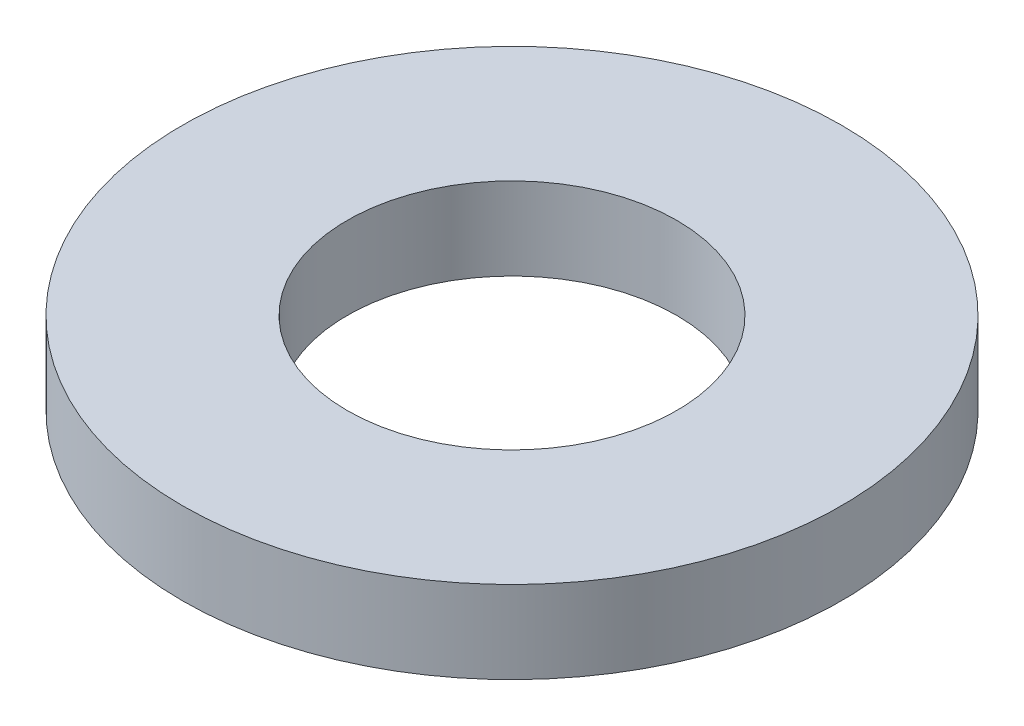
from build123d import *

# Parameters (mm, degrees)
SKETCH1_R           = 6.35
BOSS_EXTRUDE1_DEPTH = 1.5875
SKETCH2_R           = 3.175
CUT_EXTRUDE1_DEPTH  = 17.4625


with BuildPart() as part:
    # Sketch1 → Boss-Extrude1 (new body)
    with BuildSketch(Plane(origin=(0, 0, 0), x_dir=(1, 0, 0), z_dir=(0, 1, 0))):
        with Locations(Location((0, 0, 0), (0, 0, 270))):
            Circle(SKETCH1_R)
    extrude(amount=BOSS_EXTRUDE1_DEPTH)

    # Sketch2 → Cut-Extrude1 (cut)
    with BuildSketch(Plane(origin=(0, 1.5875, 0), x_dir=(1, 0, 0), z_dir=(0, 1, 0))):
        with Locations(Location((0, 0, 0), (0, 0, 270))):
            Circle(SKETCH2_R)
    extrude(amount=-CUT_EXTRUDE1_DEPTH, mode=Mode.SUBTRACT)


solid = part.part
